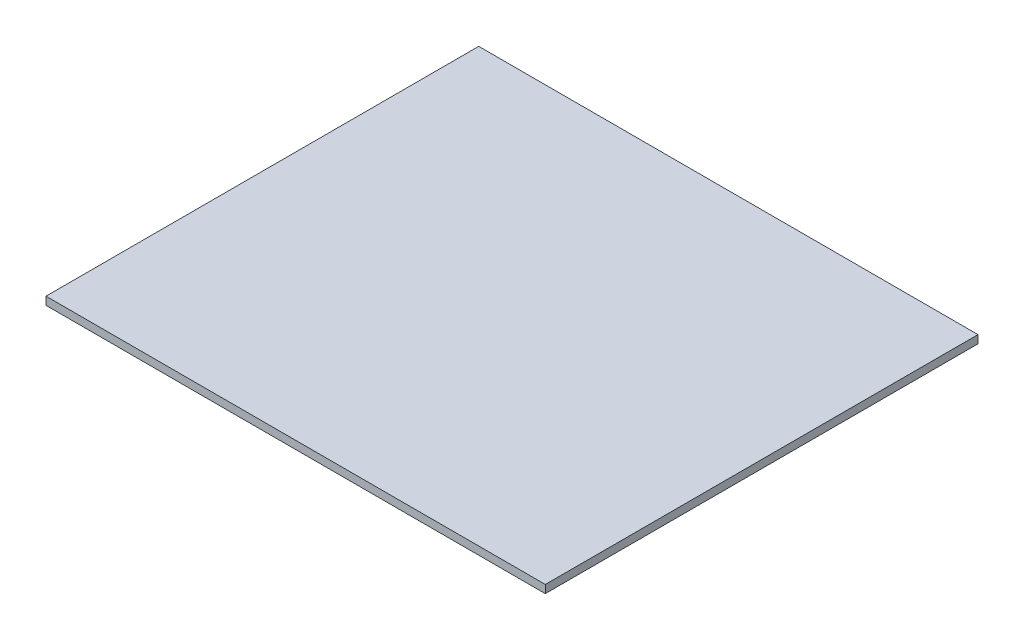
from build123d import *

# Parameters (mm, degrees)
SKETCH1_W           = 75
SKETCH1_H           = 65
BOSS_EXTRUDE1_DEPTH = 1.2


with BuildPart() as part:
    # Sketch1 → Boss-Extrude1 (new body)
    with BuildSketch(Plane(origin=(0, 0, 0), x_dir=(1, 0, 0), z_dir=(0, 1, 0))):
        Rectangle(SKETCH1_W, SKETCH1_H)
    extrude(amount=BOSS_EXTRUDE1_DEPTH)


solid = part.part
